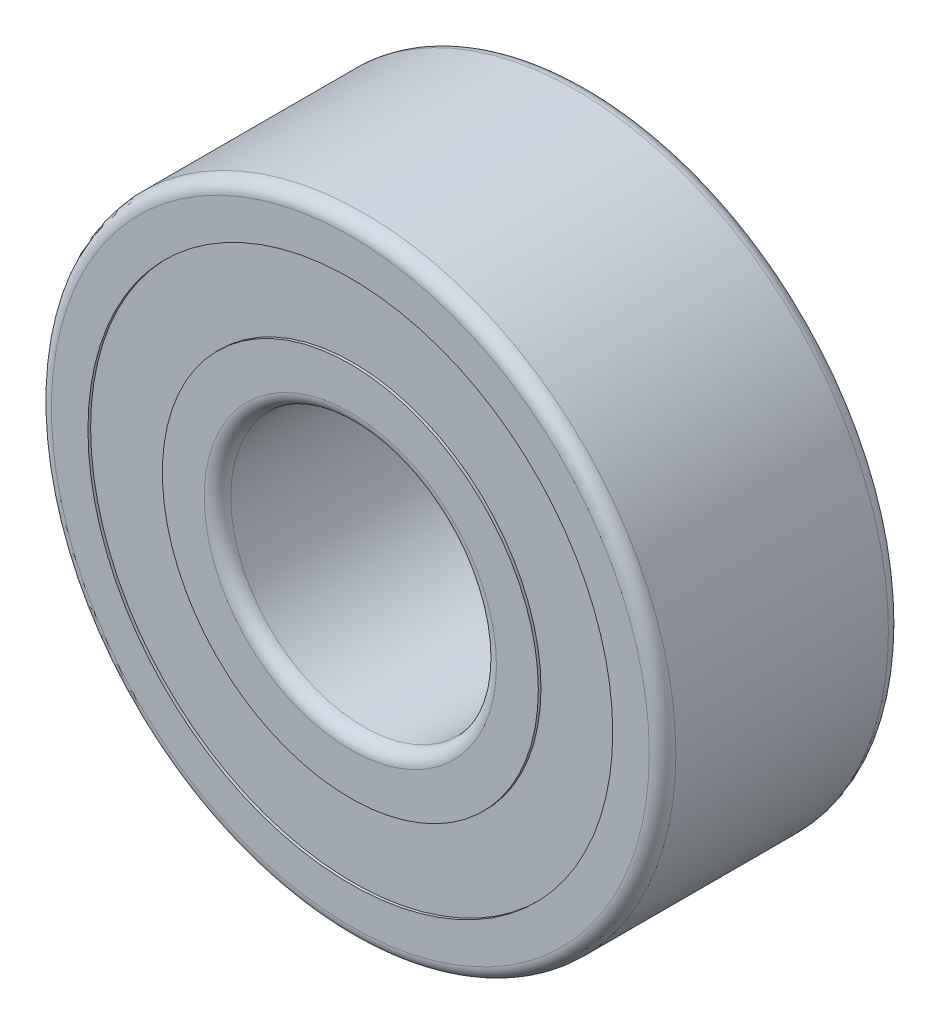
from build123d import *

# Parameters (mm, degrees)
SKETCH_1_R          = 23.5
SKETCH_1_R_2        = 10
EXTRUDE_1_DEPTH     = 18
FILLET_1_R          = 1
SKETCH_2_R          = 19.75
SKETCH_2_R_2        = 14.15
CUT_EXTRUDE_1_DEPTH = 0.2
CUT_EXTRUDE_START   = -17.8
SKETCH_2_3_R        = 19.75
SKETCH_2_3_R_2      = 14.15
CUT_EXTRUDE_2_DEPTH = 0.2


with BuildPart() as part:
    # Эскиз1 → Бобышка-Вытянуть1 (new body)
    with BuildSketch(Plane.XY):
        Circle(SKETCH_1_R)
        Circle(SKETCH_1_R_2, mode=Mode.SUBTRACT)
    extrude(amount=EXTRUDE_1_DEPTH)

    # Скругление1
    fillet_1_edges = [part.edges().sort_by_distance(p)[0] for p in [
        (-10, 0, 0),
        (-10, 0, 18),
        (-23.5, 0, 0),
        (-23.5, 0, 18),
    ]]
    fillet(fillet_1_edges, radius=FILLET_1_R)

    # Эскиз2 → Вырез-Вытянуть1 (cut)
    with BuildSketch(Plane.XY.offset(18)):
        Circle(SKETCH_2_R)
        Circle(SKETCH_2_R_2, mode=Mode.SUBTRACT)
    extrude(amount=-CUT_EXTRUDE_1_DEPTH, mode=Mode.SUBTRACT)

    # Эскиз2<3> → Вырез-Вытянуть2 (cut)
    with BuildSketch(Plane.XY.offset(18).offset(CUT_EXTRUDE_START)):
        Circle(SKETCH_2_3_R)
        Circle(SKETCH_2_3_R_2, mode=Mode.SUBTRACT)
    extrude(amount=-CUT_EXTRUDE_2_DEPTH, mode=Mode.SUBTRACT)


solid = part.part
